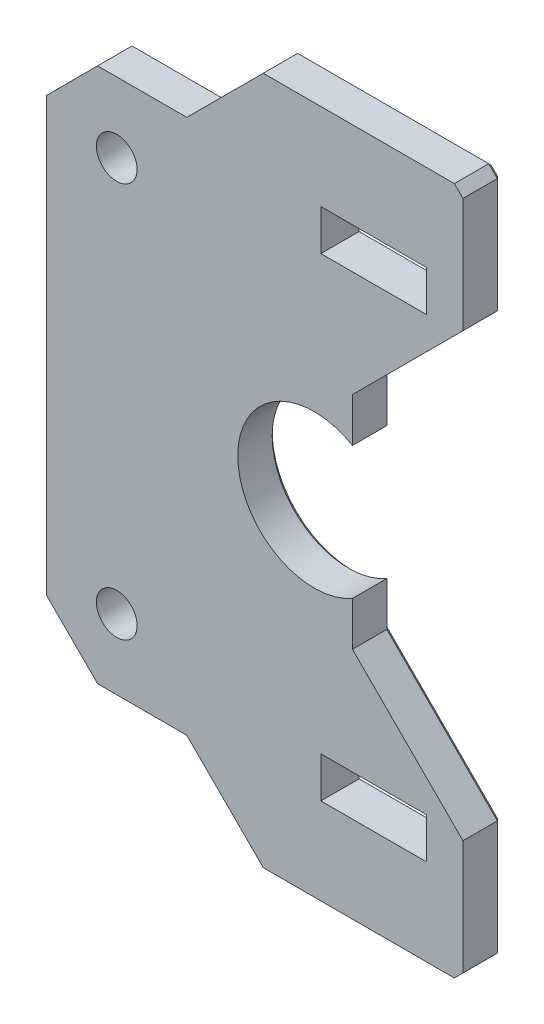
from build123d import *

# Parameters (mm, degrees)
SKETCH1_R           = 1.6
BOSS_EXTRUDE1_DEPTH = 3
CHAMFER6_SIZE       = 4
CHAMFER5_SIZE       = 0.3
SKETCH8_W           = 8.3
SKETCH8_H           = 3.2
CUT_EXTRUDE1_DEPTH  = 35.336569427


with BuildPart() as part:
    # Sketch1 → Boss-Extrude1 (new body)
    with BuildSketch(Plane.XY):
        with BuildLine():
            Line((-21, 21), (-21, -21))
            Line((-21, -21), (-10, -21))
            Line((-10, -21), (-4, -27))
            Line((-4, -27), (11, -27))
            Line((11, -27), (11.675, -26.325))
            Line((11.675, -26.325), (11.675, -17.331854249))
            Line((11.675, -17.331854249), (3, -8.656854249))
            Line((3, -8.656854249), (3, -5.196152423))
            ThreePointArc((3, -5.196152423), (-6, 0), (3, 5.196152423))
            Line((3, 5.196152423), (3, 8.656854249))
            Line((3, 8.656854249), (11.675, 17.331854249))
            Line((11.675, 17.331854249), (11.675, 26.325))
            Line((11.675, 26.325), (11, 27))
            Line((11, 27), (-4, 27))
            Line((-4, 27), (-10, 21))
            Line((-10, 21), (-21, 21))
        make_face()
        with Locations((-15.5, -15.5)):
            Circle(SKETCH1_R, mode=Mode.SUBTRACT)
        with Locations((-15.5, 15.5)):
            Circle(SKETCH1_R, mode=Mode.SUBTRACT)
    extrude(amount=BOSS_EXTRUDE1_DEPTH)

    # Chamfer6
    chamfer6_edges = [part.edges().sort_by_distance(p)[0] for p in [
        (-21, -21, 1.5),
        (-21, 21, 1.5),
    ]]
    chamfer(chamfer6_edges, length=CHAMFER6_SIZE)

    # Chamfer5
    chamfer5_edges = [part.edges().sort_by_distance(p)[0] for p in [
        (-7, 24, 0),
        (3.5, 27, 0),
        (11.3375, 26.6625, 0),
        (11.675, 21.828427125, 0),
        (7.3375, 12.994354249, 0),
        (3, 6.926503336, 0),
        (-6, 0, 0),
        (3, -6.926503336, 0),
        (7.3375, -12.994354249, 0),
        (11.675, -21.828427125, 0),
        (11.3375, -26.6625, 0),
        (3.5, -27, 0),
        (-7, -24, 0),
        (-13.5, 21, 0),
        (-17.1, -15.5, 0),
        (-17.1, 15.5, 0),
        (-21, 0, 0),
        (-13.5, -21, 0),
        (-19, -19, 0),
        (-19, 19, 0),
    ]]
    chamfer(chamfer5_edges, length=CHAMFER5_SIZE)

    # Sketch8 → Cut-Extrude1 (cut, through all)
    with BuildSketch(Plane.XY.offset(3)):
        with Locations((4.675, 18.6)):
            Rectangle(SKETCH8_W, SKETCH8_H)
        with Locations((4.675, -18.6)):
            Rectangle(SKETCH8_W, SKETCH8_H)
    extrude(amount=-CUT_EXTRUDE1_DEPTH, mode=Mode.SUBTRACT)


solid = part.part
